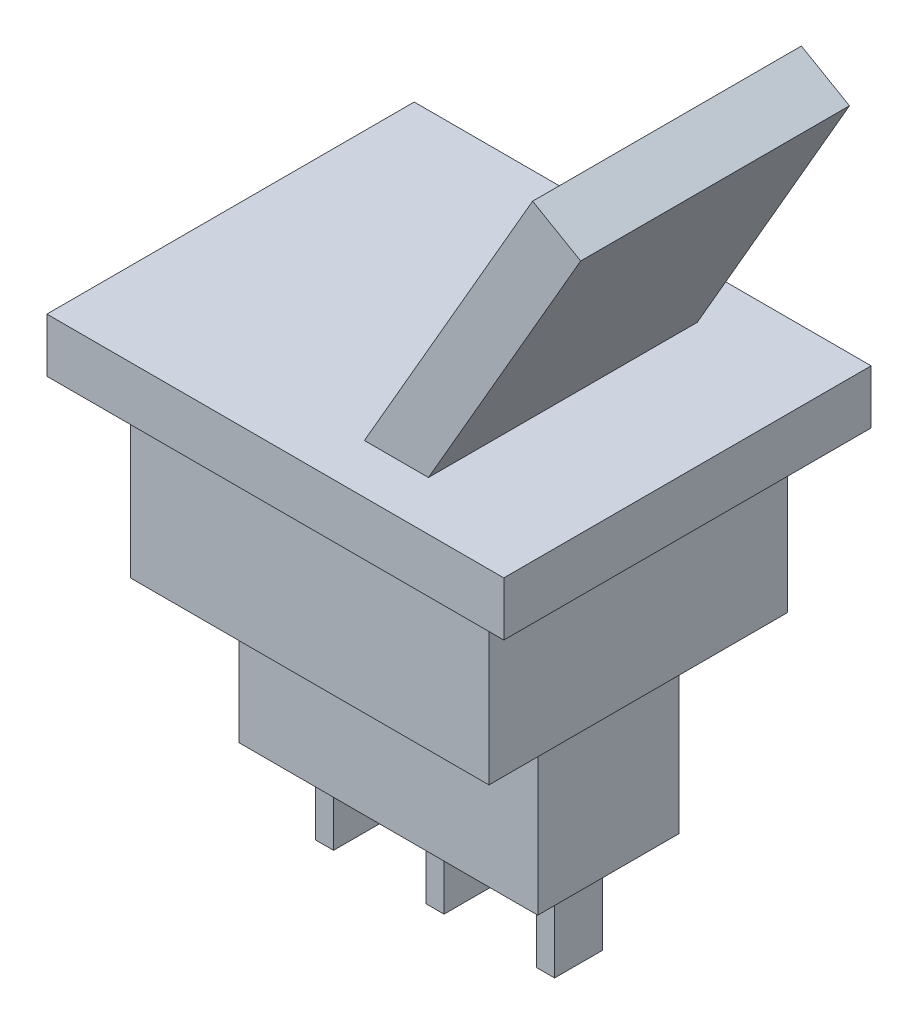
from build123d import *

# Parameters (mm, degrees)
SKETCH1_W                = 19.43
SKETCH1_H                = 15.62
BOSS_EXTRUDE1_DEPTH      = 2.29
SKETCH5_W                = 15.25
SKETCH5_H                = 12.7
BOSS_EXTRUDE2_DEPTH      = 7.11
SKETCH6_W                = 12.7
SKETCH6_H                = 6
BOSS_EXTRUDE3_DEPTH      = 7.11
SKETCH7_W                = 0.76
SKETCH7_H                = 2.03
BOSS_EXTRUDE4_DEPTH      = 3.94
BOSS_EXTRUDE5_DEPTH      = 5.715
BOSS_EXTRUDE5_DEPTH_BACK = 5.715


with BuildPart() as part:
    # Sketch1 → Boss-Extrude1 (new body)
    with BuildSketch(Plane(origin=(0, 0, 0), x_dir=(1, 0, 0), z_dir=(0, 1, 0))):
        Rectangle(SKETCH1_W, SKETCH1_H)
    extrude(amount=BOSS_EXTRUDE1_DEPTH)

    # Sketch5 → Boss-Extrude2 (add)
    with BuildSketch(Plane.XZ):
        Rectangle(SKETCH5_W, SKETCH5_H)
    extrude(amount=BOSS_EXTRUDE2_DEPTH)

    # Sketch6 → Boss-Extrude3 (add)
    with BuildSketch(Plane.XZ.offset(7.11)):
        Rectangle(SKETCH6_W, SKETCH6_H)
    extrude(amount=BOSS_EXTRUDE3_DEPTH)

    # Sketch7 → Boss-Extrude4 (add)
    with BuildSketch(Plane.XZ.offset(14.22)):
        Rectangle(SKETCH7_W, SKETCH7_H)
        with Locations((-4.7, 0)):
            Rectangle(SKETCH7_W, SKETCH7_H)
        with Locations((4.7, 0)):
            Rectangle(SKETCH7_W, SKETCH7_H)
    extrude(amount=BOSS_EXTRUDE4_DEPTH)

    # Sketch8 → Boss-Extrude5 (add, two sides: drawn at the far end of the back side and taken through both)
    with BuildSketch(Plane.XY.offset(-BOSS_EXTRUDE5_DEPTH_BACK)):
        Polygon((-1.021909976, -2.41), (1.021909976, -3.59), (10.888826077, 13.5), (8.845006124, 14.68), align=None)
    extrude(amount=BOSS_EXTRUDE5_DEPTH + BOSS_EXTRUDE5_DEPTH_BACK)


solid = part.part
